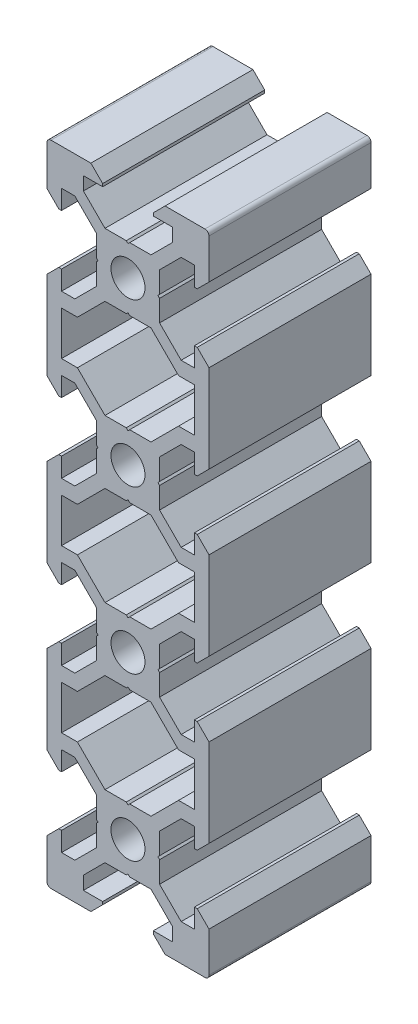
from build123d import *

# Parameters (mm, degrees)
BOSS_EXTRU_1_DEPTH = 20


with BuildPart() as part:
    # Esquisse1 → Boss.-Extru.1 (new body)
    with BuildSketch(Plane.XY):
        with BuildLine():
            Line((-9.5, 10), (-4.58, 10))
            Line((-4.58, 10), (-3.125, 8.545))
            Line((-3.125, 8.545), (-3.125, 8.2))
            Line((-3.125, 8.2), (-5.5, 8.2))
            Line((-5.5, 8.2), (-5.5, 6.560660172))
            Line((-5.5, 6.560660172), (-2.839339828, 3.9))
            Line((-2.839339828, 3.9), (-0.21, 3.9))
            Line((-0.21, 3.9), (0, 3.69))
            Line((0, 3.69), (0, 2.1))
            ThreePointArc((0, 2.1), (-2.1, 0), (0, -2.1))
            Line((0, -2.1), (0, -3.69))
            Line((0, -3.69), (-0.21, -3.9))
            Line((-0.21, -3.9), (-2.839339828, -3.9))
            Line((-2.839339828, -3.9), (-6.239339828, -7.3))
            Line((-6.239339828, -7.3), (-8.2, -7.3))
            Line((-8.2, -7.3), (-8.2, -12.7))
            Line((-8.2, -12.7), (-6.239339828, -12.7))
            Line((-6.239339828, -12.7), (-2.839339828, -16.1))
            Line((-2.839339828, -16.1), (-0.21, -16.1))
            Line((-0.21, -16.1), (0, -16.31))
            Line((0, -16.31), (0, -17.9))
            ThreePointArc((0, -17.9), (-2.1, -20), (0, -22.1))
            Line((0, -22.1), (0, -23.69))
            Line((0, -23.69), (-0.21, -23.9))
            Line((-0.21, -23.9), (-2.839339828, -23.9))
            Line((-2.839339828, -23.9), (-6.239339828, -27.3))
            Line((-6.239339828, -27.3), (-8.2, -27.3))
            Line((-8.2, -27.3), (-8.2, -32.7))
            Line((-8.2, -32.7), (-6.239339828, -32.7))
            Line((-6.239339828, -32.7), (-2.839339828, -36.1))
            Line((-2.839339828, -36.1), (-0.21, -36.1))
            Line((-0.21, -36.1), (0, -36.31))
            Line((0, -36.31), (0, -37.9))
            ThreePointArc((0, -37.9), (-2.1, -40), (0, -42.1))
            Line((0, -42.1), (0, -43.69))
            Line((0, -43.69), (-0.21, -43.9))
            Line((-0.21, -43.9), (-2.839339828, -43.9))
            Line((-2.839339828, -43.9), (-6.239339828, -47.3))
            Line((-6.239339828, -47.3), (-8.2, -47.3))
            Line((-8.2, -47.3), (-8.2, -52.7))
            Line((-8.2, -52.7), (-6.239339828, -52.7))
            Line((-6.239339828, -52.7), (-2.839339828, -56.1))
            Line((-2.839339828, -56.1), (-0.21, -56.1))
            Line((-0.21, -56.1), (0, -56.31))
            Line((0, -56.31), (0, -57.9))
            ThreePointArc((0, -57.9), (-2.1, -60), (0, -62.1))
            Line((0, -62.1), (0, -63.69))
            Line((0, -63.69), (-0.21, -63.9))
            Line((-0.21, -63.9), (-2.839339828, -63.9))
            Line((-2.839339828, -63.9), (-5.5, -66.560660172))
            Line((-5.5, -66.560660172), (-5.5, -68.2))
            Line((-5.5, -68.2), (-3.125, -68.2))
            Line((-3.125, -68.2), (-3.125, -68.545))
            Line((-3.125, -68.545), (-4.58, -70))
            Line((-4.58, -70), (-9.5, -70))
            ThreePointArc((-9.5, -70), (-9.853553391, -69.853553391), (-10, -69.5))
            Line((-10, -69.5), (-10, -64.58))
            Line((-10, -64.58), (-8.545, -63.125))
            Line((-8.545, -63.125), (-8.2, -63.125))
            Line((-8.2, -63.125), (-8.2, -65.5))
            Line((-8.2, -65.5), (-6.560660172, -65.5))
            Line((-6.560660172, -65.5), (-3.9, -62.839339828))
            Line((-3.9, -62.839339828), (-3.9, -60.21))
            Line((-3.9, -60.21), (-3.69, -60))
            Line((-3.69, -60), (-3.9, -59.79))
            Line((-3.9, -59.79), (-3.9, -57.160660172))
            Line((-3.9, -57.160660172), (-6.560660172, -54.5))
            Line((-6.560660172, -54.5), (-8.2, -54.5))
            Line((-8.2, -54.5), (-8.2, -56.875))
            Line((-8.2, -56.875), (-8.545, -56.875))
            Line((-8.545, -56.875), (-10, -55.42))
            Line((-10, -55.42), (-10, -44.58))
            Line((-10, -44.58), (-8.545, -43.125))
            Line((-8.545, -43.125), (-8.2, -43.125))
            Line((-8.2, -43.125), (-8.2, -45.5))
            Line((-8.2, -45.5), (-6.560660172, -45.5))
            Line((-6.560660172, -45.5), (-3.9, -42.839339828))
            Line((-3.9, -42.839339828), (-3.9, -40.21))
            Line((-3.9, -40.21), (-3.69, -40))
            Line((-3.69, -40), (-3.9, -39.79))
            Line((-3.9, -39.79), (-3.9, -37.160660172))
            Line((-3.9, -37.160660172), (-6.560660172, -34.5))
            Line((-6.560660172, -34.5), (-8.2, -34.5))
            Line((-8.2, -34.5), (-8.2, -36.875))
            Line((-8.2, -36.875), (-8.545, -36.875))
            Line((-8.545, -36.875), (-10, -35.42))
            Line((-10, -35.42), (-10, -24.58))
            Line((-10, -24.58), (-8.545, -23.125))
            Line((-8.545, -23.125), (-8.2, -23.125))
            Line((-8.2, -23.125), (-8.2, -25.5))
            Line((-8.2, -25.5), (-6.560660172, -25.5))
            Line((-6.560660172, -25.5), (-3.9, -22.839339828))
            Line((-3.9, -22.839339828), (-3.9, -20.21))
            Line((-3.9, -20.21), (-3.69, -20))
            Line((-3.69, -20), (-3.9, -19.79))
            Line((-3.9, -19.79), (-3.9, -17.160660172))
            Line((-3.9, -17.160660172), (-6.560660172, -14.5))
            Line((-6.560660172, -14.5), (-8.2, -14.5))
            Line((-8.2, -14.5), (-8.2, -16.875))
            Line((-8.2, -16.875), (-8.545, -16.875))
            Line((-8.545, -16.875), (-10, -15.42))
            Line((-10, -15.42), (-10, -4.58))
            Line((-10, -4.58), (-8.545, -3.125))
            Line((-8.545, -3.125), (-8.2, -3.125))
            Line((-8.2, -3.125), (-8.2, -5.5))
            Line((-8.2, -5.5), (-6.560660172, -5.5))
            Line((-6.560660172, -5.5), (-3.9, -2.839339828))
            Line((-3.9, -2.839339828), (-3.9, -0.21))
            Line((-3.9, -0.21), (-3.69, 0))
            Line((-3.69, 0), (-3.9, 0.21))
            Line((-3.9, 0.21), (-3.9, 2.839339828))
            Line((-3.9, 2.839339828), (-6.560660172, 5.5))
            Line((-6.560660172, 5.5), (-8.2, 5.5))
            Line((-8.2, 5.5), (-8.2, 3.125))
            Line((-8.2, 3.125), (-8.545, 3.125))
            Line((-8.545, 3.125), (-10, 4.58))
            Line((-10, 4.58), (-10, 9.5))
            ThreePointArc((-10, 9.5), (-9.853553391, 9.853553391), (-9.5, 10))
        make_face()
    boss_extru_1 = extrude(amount=BOSS_EXTRU_1_DEPTH)

    # Symétrie1: Boss.-Extru.1 across plane
    add(boss_extru_1.mirror(Plane(origin=(0, 3.69, 20), x_dir=(0, 0, 1), z_dir=(-1, 0, 0))))


solid = part.part
